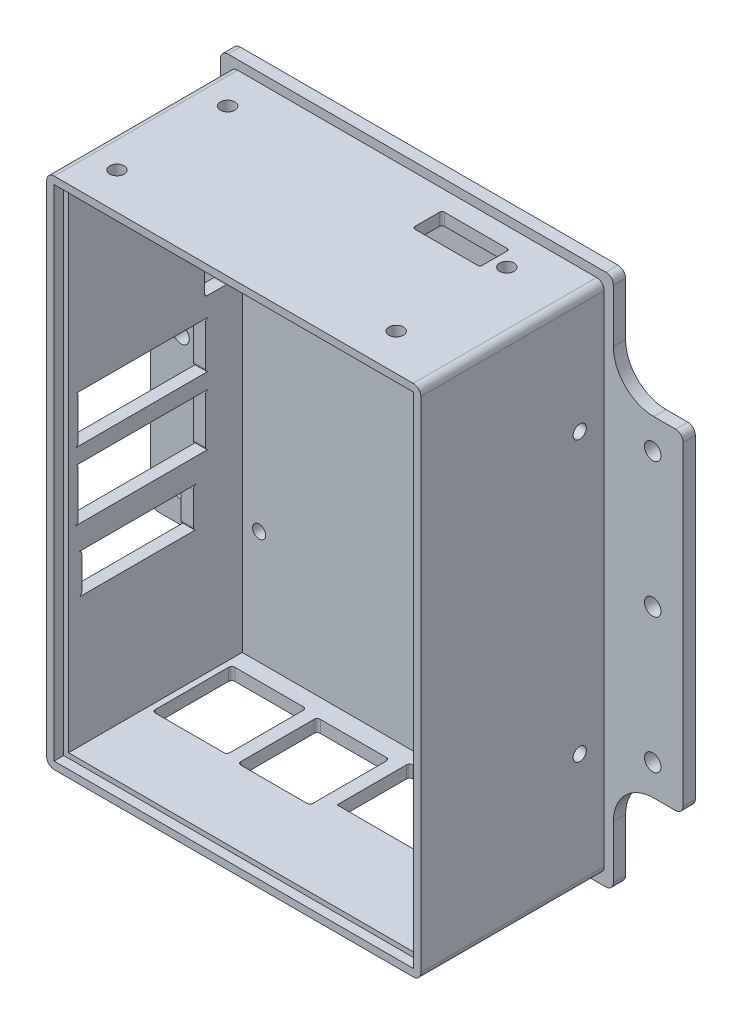
from build123d import *

# Parameters (mm, degrees)
SKETCH1_R              = 1.7145
BASE_DEPTH             = 2.54
SKETCH2_W              = 72.651204731
SKETCH2_H              = 101.727
WALL_DEPTH             = 38.1
USB_ETH_DEPTH          = 2.54
USBC_START             = -2.54
USBC_AUDIO_HDMI_DEPTH  = 2.54
SKETCH6_R              = 1.5
BERRYGPS_MOUNT_DEPTH   = 2.54
SKETCH7_W              = 74.651204731
SKETCH7_H              = 103.727
LID_RIDGE_DEPTH        = 2
CUT_EXTRUDE6_REACH     = 114.887
BREADBOARD_SLICE_DEPTH = 2
SKETCH11_R             = 1.35
PI_MOUNTING_DEPTH      = 2.54
SKETCH12_R             = 1.375
CUT_EXTRUDE7_DEPTH     = 2.54


with BuildPart() as part:
    # Sketch1 → Base (new body)
    with BuildSketch(Plane.XY):
        with BuildLine():
            Line((-40.814075, 42.746875), (-40.814075, 53.732375))
            ThreePointArc((-40.814075, 53.732375), (-40.352826759, 54.845926759), (-39.239275, 55.307175))
            Line((-39.239275, 55.307175), (39.246725, 55.307175))
            ThreePointArc((39.246725, 55.307175), (40.360276759, 54.845926759), (40.821525, 53.732375))
            Line((40.821525, 53.732375), (40.821525, 42.746875))
            ThreePointArc((40.821525, 42.746875), (43.291434936, 36.783984936), (49.254325, 34.314075))
            Line((49.254325, 34.314075), (53.737425, 34.314075))
            ThreePointArc((53.737425, 34.314075), (54.850976759, 33.852826759), (55.312225, 32.739275))
            Line((55.312225, 32.739275), (55.312225, -32.741925))
            ThreePointArc((55.312225, -32.741925), (54.850976759, -33.855476759), (53.737425, -34.316725))
            Line((53.737425, -34.316725), (49.254325, -34.316725))
            ThreePointArc((49.254325, -34.316725), (43.291434936, -36.786634936), (40.821525, -42.749525))
            Line((40.821525, -42.749525), (40.821525, -53.735025))
            ThreePointArc((40.821525, -53.735025), (40.360276759, -54.848576759), (39.246725, -55.309825))
            Line((39.246725, -55.309825), (-39.239275, -55.309825))
            ThreePointArc((-39.239275, -55.309825), (-40.352826759, -54.848576759), (-40.814075, -53.735025))
            Line((-40.814075, -53.735025), (-40.814075, -42.749525))
            ThreePointArc((-40.814075, -42.749525), (-43.283984936, -36.786634936), (-49.246875, -34.316725))
            Line((-49.246875, -34.316725), (-53.729975, -34.316725))
            ThreePointArc((-53.729975, -34.316725), (-54.843526759, -33.855476759), (-55.304775, -32.741925))
            Line((-55.304775, -32.741925), (-55.304775, 32.739275))
            ThreePointArc((-55.304775, 32.739275), (-54.843526759, 33.852826759), (-53.729975, 34.314075))
            Line((-53.729975, 34.314075), (-49.246875, 34.314075))
            ThreePointArc((-49.246875, 34.314075), (-43.283984936, 36.783984936), (-40.814075, 42.746875))
        make_face()
        with Locations((49, -28)):
            Circle(SKETCH1_R, mode=Mode.SUBTRACT)
        with Locations((49, 0)):
            Circle(SKETCH1_R, mode=Mode.SUBTRACT)
        with Locations((49, 28)):
            Circle(SKETCH1_R, mode=Mode.SUBTRACT)
        with Locations((-49, -28)):
            Circle(SKETCH1_R, mode=Mode.SUBTRACT)
        with Locations((-49, 0)):
            Circle(SKETCH1_R, mode=Mode.SUBTRACT)
        with Locations((-49, 28)):
            Circle(SKETCH1_R, mode=Mode.SUBTRACT)
    extrude(amount=BASE_DEPTH)

    # Sketch2 → Wall (add)
    with BuildSketch(Plane.XY.offset(2.54)):
        with BuildLine():
            Line((-37.239879731, 53.402175), (37.341725, 53.402175))
            ThreePointArc((37.341725, 53.402175), (38.455276759, 52.940926759), (38.916525, 51.827375))
            Line((38.916525, 51.827375), (38.916525, -51.830025))
            ThreePointArc((38.916525, -51.830025), (38.455276759, -52.943576759), (37.341725, -53.404825))
            Line((37.341725, -53.404825), (-37.239879731, -53.404825))
            ThreePointArc((-37.239879731, -53.404825), (-38.35343149, -52.943576759), (-38.814679731, -51.830025))
            Line((-38.814679731, -51.830025), (-38.814679731, -34.316725))
            Line((-38.814679731, -34.316725), (-44.298549242, -34.316725))
            Line((-44.298549242, -34.316725), (-44.298549242, -31.141725))
            Line((-44.298549242, -31.141725), (-38.814679731, -31.141725))
            Line((-38.814679731, -31.141725), (-38.814679731, 31.139075))
            Line((-38.814679731, 31.139075), (-44.298549242, 31.139075))
            Line((-44.298549242, 31.139075), (-44.298549242, 34.314075))
            Line((-44.298549242, 34.314075), (-38.814679731, 34.314075))
            Line((-38.814679731, 34.314075), (-38.814679731, 51.827375))
            ThreePointArc((-38.814679731, 51.827375), (-38.35343149, 52.940926759), (-37.239879731, 53.402175))
        make_face()
        with Locations((0.050922635, -0.001325)):
            Rectangle(SKETCH2_W, SKETCH2_H, mode=Mode.SUBTRACT)
    extrude(amount=WALL_DEPTH)

    # Sketch4 → USB + Eth (cut)
    with BuildSketch(Plane(origin=(0, -50.864825, 0), x_dir=(1, 0, 0), z_dir=(0, 1, 0))):
        with BuildLine():
            Line((-20.159679731, -5.988796842), (-34.389679731, -5.988796842))
            ThreePointArc((-34.389679731, -5.988796842), (-34.838692537, -6.174784036), (-35.024679731, -6.623796842))
            Line((-35.024679731, -6.623796842), (-35.024679731, -21.853796842))
            ThreePointArc((-35.024679731, -21.853796842), (-34.838692537, -22.302809649), (-34.389679731, -22.488796842))
            Line((-34.389679731, -22.488796842), (-20.159679731, -22.488796842))
            ThreePointArc((-20.159679731, -22.488796842), (-19.710666925, -22.302809649), (-19.524679731, -21.853796842))
            Line((-19.524679731, -21.853796842), (-19.524679731, -6.623796842))
            ThreePointArc((-19.524679731, -6.623796842), (-19.710666925, -6.174784036), (-20.159679731, -5.988796842))
        make_face()
        with BuildLine():
            Line((-16.139679731, -6.473356394), (-2.409679731, -6.473356394))
            ThreePointArc((-2.409679731, -6.473356394), (-1.960666925, -6.659343587), (-1.774679731, -7.108356394))
            Line((-1.774679731, -7.108356394), (-1.774679731, -22.338356394))
            ThreePointArc((-1.774679731, -22.338356394), (-1.960666925, -22.7873692), (-2.409679731, -22.973356394))
            Line((-2.409679731, -22.973356394), (-16.139679731, -22.973356394))
            ThreePointArc((-16.139679731, -22.973356394), (-16.588692537, -22.7873692), (-16.774679731, -22.338356394))
            Line((-16.774679731, -22.338356394), (-16.774679731, -7.108356394))
            ThreePointArc((-16.774679731, -7.108356394), (-16.588692537, -6.659343587), (-16.139679731, -6.473356394))
        make_face()
        with BuildLine():
            Line((1.009193125, -20.127304454), (17.941447413, -20.127304454))
            Line((17.941447413, -20.127304454), (17.941447413, -5.690494043))
            ThreePointArc((17.941447413, -5.690494043), (17.755460219, -5.241481237), (17.306447413, -5.055494043))
            Line((17.306447413, -5.055494043), (1.644193125, -5.055494043))
            ThreePointArc((1.644193125, -5.055494043), (1.195180319, -5.241481237), (1.009193125, -5.690494043))
            Line((1.009193125, -5.690494043), (1.009193125, -20.127304454))
        make_face()
    extrude(amount=-USB_ETH_DEPTH, mode=Mode.SUBTRACT)

    # Sketch5 → USBC + Audio + HDMI (cut)
    with BuildSketch(Plane(origin=(-36.274679731, 0, 0), x_dir=(0, 0, -1), z_dir=(1, 0, 0)).offset(USBC_START)):
        with BuildLine():
            Line((-12.090812846, -23.954696095), (-36.5235829, -23.954696095))
            ThreePointArc((-36.5235829, -23.954696095), (-36.074570094, -23.768708901), (-35.8885829, -23.319696095))
            Line((-35.8885829, -23.319696095), (-35.8885829, -16.409953985))
            ThreePointArc((-35.8885829, -16.409953985), (-36.074570094, -15.960941179), (-36.5235829, -15.774953985))
            Line((-36.5235829, -15.774953985), (-12.090812846, -15.774953985))
            ThreePointArc((-12.090812846, -15.774953985), (-12.539825652, -15.960941179), (-12.725812846, -16.409953985))
            Line((-12.725812846, -16.409953985), (-12.725812846, -23.319696095))
            ThreePointArc((-12.725812846, -23.319696095), (-12.539825652, -23.768708901), (-12.090812846, -23.954696095))
        make_face()
        with BuildLine():
            Line((-10.38280776, 17.60635587), (-10.38280776, 28.26399405))
            ThreePointArc((-10.38280776, 28.26399405), (-10.196820566, 28.713006856), (-9.74780776, 28.89899405))
            Line((-9.74780776, 28.89899405), (-5.96180776, 28.89899405))
            ThreePointArc((-5.96180776, 28.89899405), (-5.512794953, 28.713006856), (-5.32680776, 28.26399405))
            Line((-5.32680776, 28.26399405), (-5.32680776, 17.60635587))
            ThreePointArc((-5.32680776, 17.60635587), (-5.512794953, 17.157343064), (-5.96180776, 16.97135587))
            Line((-5.96180776, 16.97135587), (-9.74780776, 16.97135587))
            ThreePointArc((-9.74780776, 16.97135587), (-10.196820566, 17.157343064), (-10.38280776, 17.60635587))
        make_face()
        with BuildLine():
            Line((-10.167757485, 3.894348255), (-10.167757485, 12.376001665))
            ThreePointArc((-10.167757485, 12.376001665), (-9.981770291, 12.825014471), (-9.532757485, 13.011001665))
            Line((-9.532757485, 13.011001665), (-37.2735829, 13.011001665))
            ThreePointArc((-37.2735829, 13.011001665), (-36.824570094, 12.825014471), (-36.6385829, 12.376001665))
            Line((-36.6385829, 12.376001665), (-36.6385829, 3.894348255))
            ThreePointArc((-36.6385829, 3.894348255), (-36.824570094, 3.445335449), (-37.2735829, 3.259348255))
            Line((-37.2735829, 3.259348255), (-9.532757485, 3.259348255))
            ThreePointArc((-9.532757485, 3.259348255), (-9.981770291, 3.445335449), (-10.167757485, 3.894348255))
        make_face()
        with BuildLine():
            Line((-10.167757485, -10.14671347), (-10.167757485, -0.58293661))
            ThreePointArc((-10.167757485, -0.58293661), (-9.981770291, -0.133923804), (-9.532757485, 0.05206339))
            Line((-9.532757485, 0.05206339), (-37.2735829, 0.05206339))
            ThreePointArc((-37.2735829, 0.05206339), (-36.824570094, -0.133923804), (-36.6385829, -0.58293661))
            Line((-36.6385829, -0.58293661), (-36.6385829, -10.14671347))
            ThreePointArc((-36.6385829, -10.14671347), (-36.824570094, -10.595726276), (-37.2735829, -10.78171347))
            Line((-37.2735829, -10.78171347), (-9.532757485, -10.78171347))
            ThreePointArc((-9.532757485, -10.78171347), (-9.981770291, -10.595726276), (-10.167757485, -10.14671347))
        make_face()
    extrude(amount=USBC_AUDIO_HDMI_DEPTH, mode=Mode.SUBTRACT)

    # Sketch6 → BerryGPS Mount (cut)
    with BuildSketch(Plane(origin=(0, 50.862175, 0), x_dir=(-1, 0, 0), z_dir=(0, -1, 0))):
        with Locations(Location((31.829679731, -33.02, 0), (0, 0, 90))):
            Circle(SKETCH6_R)
        with Locations(Location((31.829679731, -10.02, 0), (0, 0, 90))):
            Circle(SKETCH6_R)
        with Locations(Location((-26.170320269, -33.02, 0), (0, 0, 90))):
            Circle(SKETCH6_R)
        with Locations(Location((-26.170320269, -10.02, 0), (0, 0, 90))):
            Circle(SKETCH6_R)
        with BuildLine():
            Line((-22.780320269, -12.72), (-9.780320269, -12.72))
            ThreePointArc((-9.780320269, -12.72), (-9.426766879, -12.573553391), (-9.280320269, -12.22))
            Line((-9.280320269, -12.22), (-9.280320269, -7.1))
            ThreePointArc((-9.280320269, -7.1), (-9.426766879, -6.746446609), (-9.780320269, -6.6))
            Line((-9.780320269, -6.6), (-22.780320269, -6.6))
            ThreePointArc((-22.780320269, -6.6), (-23.13387366, -6.746446609), (-23.280320269, -7.1))
            Line((-23.280320269, -7.1), (-23.280320269, -12.22))
            ThreePointArc((-23.280320269, -12.22), (-23.13387366, -12.573553391), (-22.780320269, -12.72))
        make_face()
    extrude(amount=-BERRYGPS_MOUNT_DEPTH, mode=Mode.SUBTRACT)

    # Sketch7 → Lid ridge (cut)
    with BuildSketch(Plane.XY.offset(40.64)):
        with Locations((0.050922635, -0.001325)):
            Rectangle(SKETCH7_W, SKETCH7_H)
    extrude(amount=-LID_RIDGE_DEPTH, mode=Mode.SUBTRACT)

    # Cut-Extrude6: up to this face of the body (flat: up to its plane)
    cut_extrude6_end = Plane(part.part.faces().sort_by_distance((-41.556614486, 34.314075, 21.59))[0])
    # Sketch9 → Cut-Extrude6 (cut, up to the picked face)
    with BuildSketch(Plane.XZ.offset(34.316725), mode=Mode.PRIVATE) as cut_extrude6_sk1:
        Polygon((-38.814679731, 40.64), (-44.298549242, 2.54), (-44.298549242, 40.64), align=None)
    cut_extrude6_tool1 = split(extrude(cut_extrude6_sk1.sketch, amount=-CUT_EXTRUDE6_REACH, mode=Mode.PRIVATE), bisect_by=cut_extrude6_end, keep=Keep.BOTH, mode=Mode.PRIVATE)
    add(cut_extrude6_tool1.solids().sort_by(Axis((-42.470593, -34.316725, 27.94), (0, 1, 0)))[0], mode=Mode.SUBTRACT)

    # Sketch10 → Breadboard slice (cut)
    with BuildSketch(Plane.XY.offset(2.54)):
        with BuildLine():
            Line((32.189731656, 40.748675), (29.039731656, 40.748675))
            ThreePointArc((29.039731656, 40.748675), (27.539731656, 42.248675), (26.039731656, 40.748675))
            Line((26.039731656, 40.748675), (22.889731656, 40.748675))
            Line((22.889731656, 40.748675), (22.889731656, -40.751325))
            Line((22.889731656, -40.751325), (32.189731656, -40.751325))
            Line((32.189731656, -40.751325), (32.189731656, -28.251325))
            ThreePointArc((32.189731656, -28.251325), (33.689731656, -26.751325), (32.189731656, -25.251325))
            Line((32.189731656, -25.251325), (32.189731656, 25.248675))
            ThreePointArc((32.189731656, 25.248675), (33.689731656, 26.748675), (32.189731656, 28.248675))
            Line((32.189731656, 28.248675), (32.189731656, 40.748675))
        make_face()
    extrude(amount=-BREADBOARD_SLICE_DEPTH, mode=Mode.SUBTRACT)

    # Sketch11 → Pi Mounting (cut)
    with BuildSketch(Plane.XY.offset(2.54)):
        with Locations((-32.774679731, 30.635175)):
            Circle(SKETCH11_R)
        with Locations((16.225320269, 30.635175)):
            Circle(SKETCH11_R)
        with Locations((16.225320269, -27.364825)):
            Circle(SKETCH11_R)
        with Locations((-32.774679731, -27.364825)):
            Circle(SKETCH11_R)
    extrude(amount=-PI_MOUNTING_DEPTH, mode=Mode.SUBTRACT)

    # Sketch12 → Cut-Extrude7 (cut)
    with BuildSketch(Plane(origin=(38.916525, 0, 0), x_dir=(0, 0, -1), z_dir=(1, 0, 0))):
        with Locations(Location((-7.62, 28.998675, 0), (0, 0, 90))):
            Circle(SKETCH12_R)
        with Locations(Location((-7.62, -29.001325, 0), (0, 0, 90))):
            Circle(SKETCH12_R)
    extrude(amount=-CUT_EXTRUDE7_DEPTH, mode=Mode.SUBTRACT)


solid = part.part
